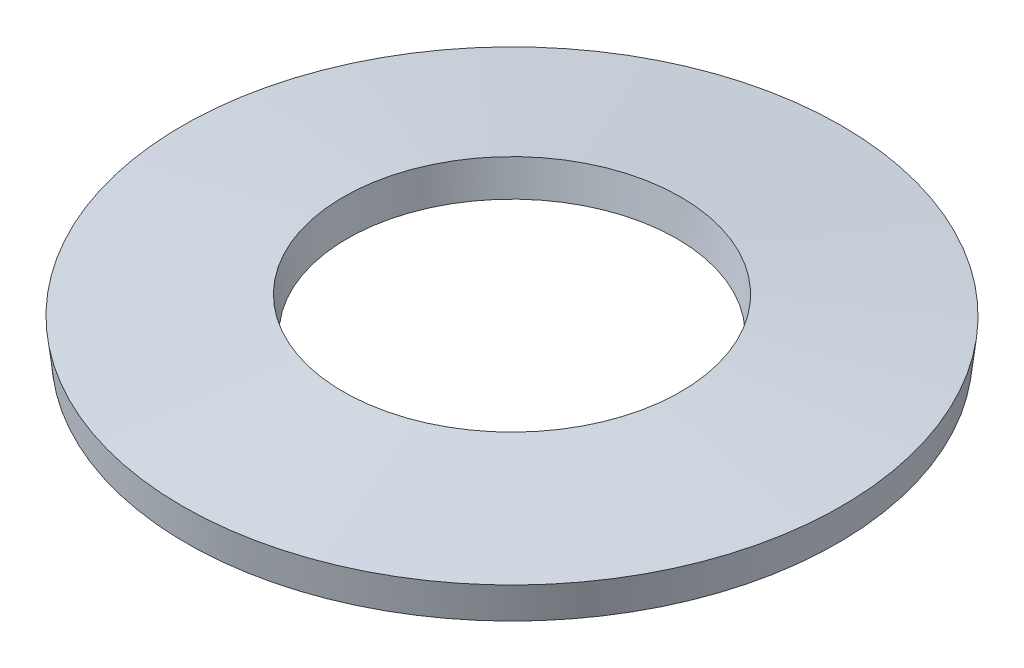
from build123d import *


with BuildPart() as part:
    # Sketch1 → Revolve1 (revolve)
    with BuildSketch(Plane.XY, mode=Mode.PRIVATE) as revolve1_sk:
        Polygon((3.1368942, 0), (1.5875, 0.180006116), (1.6256058, 0.508), (3.175, 0.327993884), align=None)
    revolve(revolve1_sk.sketch.rotate(Axis((0, 0, 0), (0, 1, 0)), 90), axis=Axis((0, 0, 0), (0, 1, 0)))


solid = part.part
